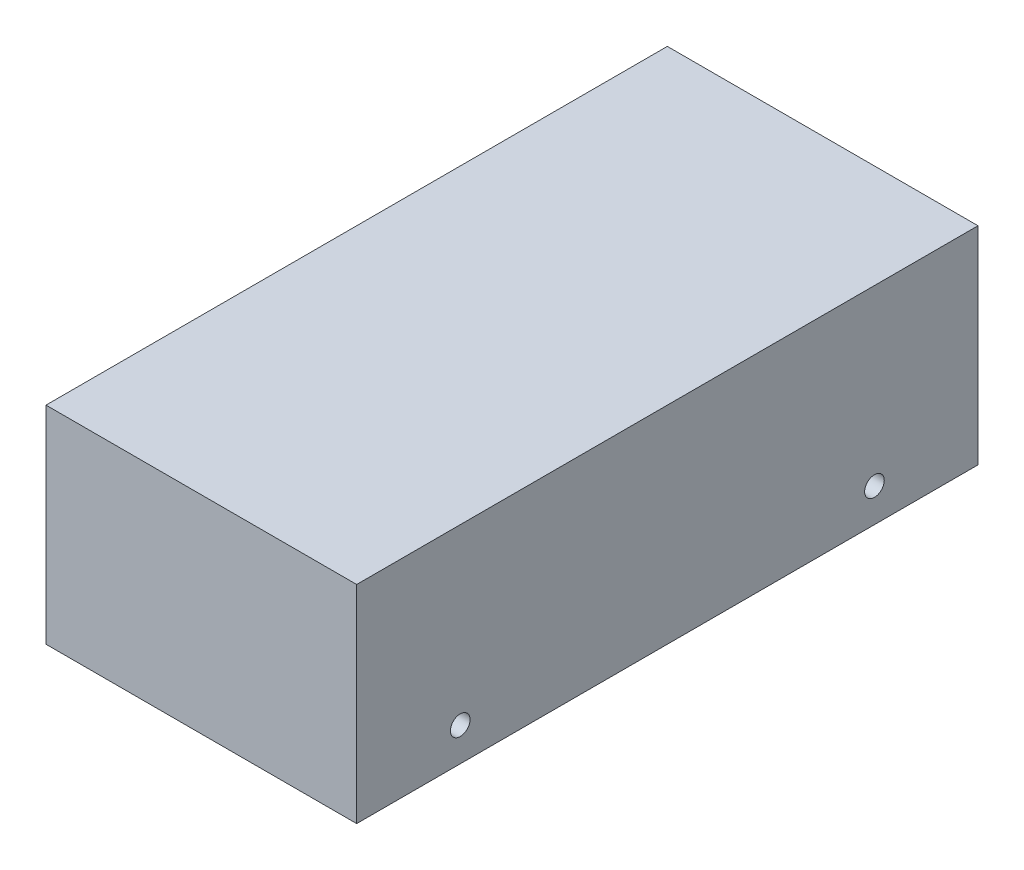
from build123d import *

# Parameters (mm, degrees)
SKETCH1_W           = 75
SKETCH1_H           = 50
BOSS_EXTRUDE1_DEPTH = 150
SKETCH2_R           = 2.369647205
CUT_EXTRUDE1_DEPTH  = 10
CUT_EXTRUDE2_START  = -10
SKETCH3_R           = 2.369647205
CUT_EXTRUDE2_DEPTH  = 10


with BuildPart() as part:
    # Sketch1 → Boss-Extrude1 (new body)
    with BuildSketch(Plane.XY):
        Rectangle(SKETCH1_W, SKETCH1_H)
    extrude(amount=BOSS_EXTRUDE1_DEPTH)

    # Sketch2 → Cut-Extrude1 (cut)
    with BuildSketch(Plane(origin=(37.5, 0, 0), x_dir=(0, 0, -1), z_dir=(1, 0, 0))):
        with Locations(Location((-125, -16.919154578, 0), (0, 0, 90))):
            Circle(SKETCH2_R)
        with Locations(Location((-25, -16.919154578, 0), (0, 0, 90))):
            Circle(SKETCH2_R)
    extrude(amount=-CUT_EXTRUDE1_DEPTH, mode=Mode.SUBTRACT)

    # Sketch3 → Cut-Extrude2 (cut)
    with BuildSketch(Plane.ZY.offset(37.5).offset(CUT_EXTRUDE2_START)):
        with Locations(Location((25, -16.919154578, 0), (0, 0, 90))):
            Circle(SKETCH3_R)
        with Locations(Location((125, -16.919154578, 0), (0, 0, 90))):
            Circle(SKETCH3_R)
    extrude(amount=CUT_EXTRUDE2_DEPTH, mode=Mode.SUBTRACT)


solid = part.part
